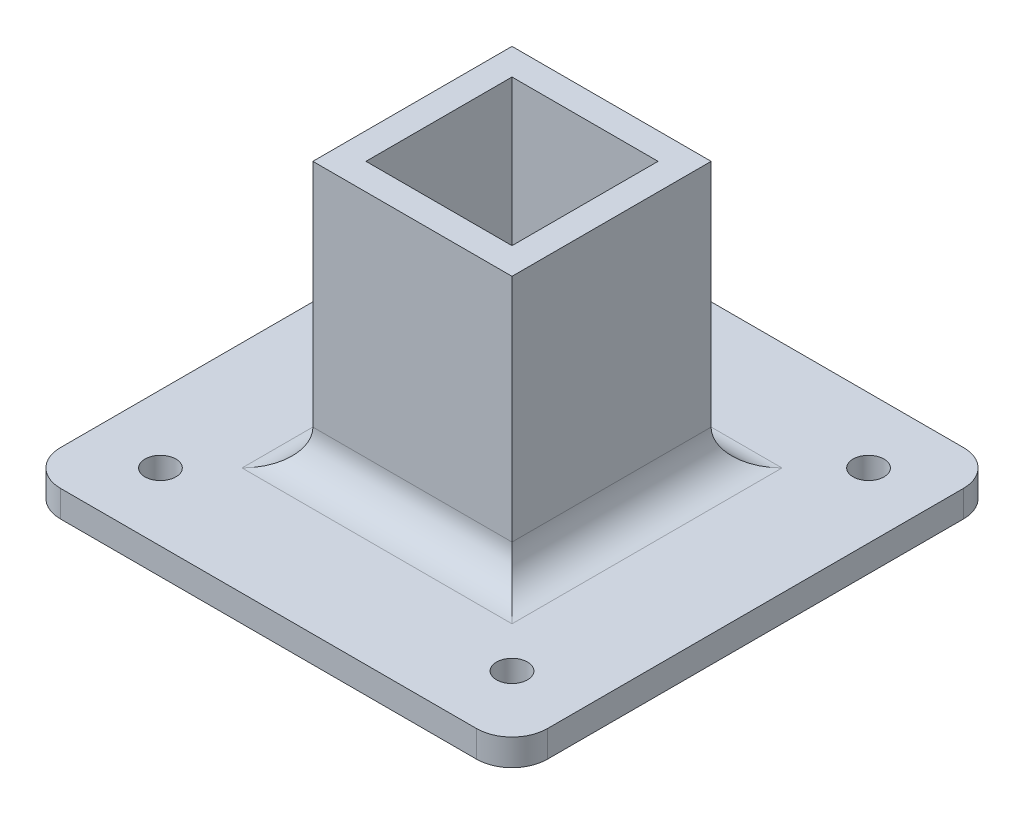
from build123d import *

# Parameters (mm, degrees)
SKETCH1_W           = 55
SKETCH1_H           = 55
SKETCH1_R           = 1.75
BOSS_EXTRUDE1_DEPTH = 3
SKETCH2_W           = 22.5
SKETCH2_H           = 22.5
SKETCH2_W_2         = 16.5
SKETCH2_H_2         = 16.5
BOSS_EXTRUDE2_DEPTH = 30
SKETCH3_W           = 16.5
SKETCH3_H           = 16.5
CUT_EXTRUDE1_DEPTH  = 30
FILLET1_R           = 4
FILLET2_R           = 4


with BuildPart() as part:
    # Sketch1 → Boss-Extrude1 (new body)
    with BuildSketch(Plane(origin=(0, 0, 0), x_dir=(1, 0, 0), z_dir=(0, 1, 0))):
        Rectangle(SKETCH1_W, SKETCH1_H)
        with Locations(Location((20.140368527, 20.140368527, 0), (0, 0, 270))):
            Circle(SKETCH1_R, mode=Mode.SUBTRACT)
        with Locations(Location((-19.859631473, -19.859631473, 0), (0, 0, 270))):
            Circle(SKETCH1_R, mode=Mode.SUBTRACT)
        with Locations(Location((-20.140368527, 20.140368527, 0), (0, 0, 90))):
            Circle(SKETCH1_R, mode=Mode.SUBTRACT)
        with Locations(Location((19.859631473, -19.859631473, 0), (0, 0, 90))):
            Circle(SKETCH1_R, mode=Mode.SUBTRACT)
    extrude(amount=BOSS_EXTRUDE1_DEPTH)

    # Sketch2 → Boss-Extrude2 (add)
    with BuildSketch(Plane(origin=(0, 3, 0), x_dir=(1, 0, 0), z_dir=(0, 1, 0))):
        Rectangle(SKETCH2_W, SKETCH2_H)
        Rectangle(SKETCH2_W_2, SKETCH2_H_2, mode=Mode.SUBTRACT)
    extrude(amount=BOSS_EXTRUDE2_DEPTH)

    # Sketch3 → Cut-Extrude1 (cut)
    with BuildSketch(Plane(origin=(0, 3, 0), x_dir=(1, 0, 0), z_dir=(0, 1, 0))):
        Rectangle(SKETCH3_W, SKETCH3_H)
    extrude(amount=-CUT_EXTRUDE1_DEPTH, mode=Mode.SUBTRACT)

    # Fillet1
    fillet1_edges = [part.edges().sort_by_distance(p)[0] for p in [
        (-11.25, 3, 0),
        (0, 3, 11.25),
        (11.25, 3, 0),
        (0, 3, -11.25),
    ]]
    fillet(fillet1_edges, radius=FILLET1_R)

    # Fillet2
    fillet2_edges = [part.edges().sort_by_distance(p)[0] for p in [
        (27.5, 1.5, 27.5),
        (-27.5, 1.5, 27.5),
        (-27.5, 1.5, -27.5),
        (27.5, 1.5, -27.5),
    ]]
    fillet(fillet2_edges, radius=FILLET2_R)


solid = part.part
